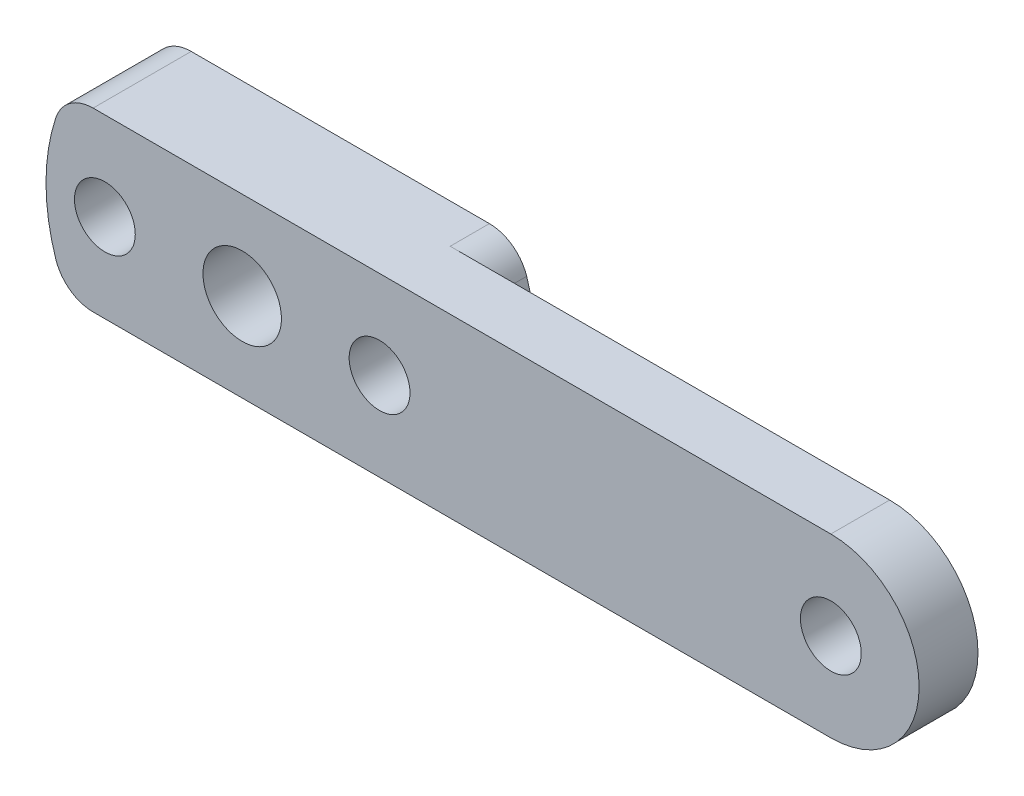
from build123d import *

# Parameters (mm, degrees)
SKETCH1_R           = 1.55
SKETCH1_R_2         = 2
BOSS_EXTRUDE1_DEPTH = 2.5
CUT_EXTRUDE1_START  = -2
CUT_EXTRUDE1_DEPTH  = 2
FILLET1_R           = 2


with BuildPart() as part:
    # Sketch1 → Boss-Extrude1 (new, symmetric)
    with BuildSketch(Plane.XY):
        with BuildLine():
            Line((-8.93028555, 4.5), (30, 4.5))
            ThreePointArc((30, 4.5), (34.5, 0), (30, -4.5))
            Line((30, -4.5), (-8.93028555, -4.5))
            ThreePointArc((-8.93028555, -4.5), (-10, 0), (-8.93028555, 4.5))
        make_face()
        with Locations((-7, 0)):
            Circle(SKETCH1_R, mode=Mode.SUBTRACT)
        with Locations((7, 0)):
            Circle(SKETCH1_R, mode=Mode.SUBTRACT)
        with Locations((30, 0)):
            Circle(SKETCH1_R, mode=Mode.SUBTRACT)
        Circle(SKETCH1_R_2, mode=Mode.SUBTRACT)
    extrude(amount=BOSS_EXTRUDE1_DEPTH, both=True)

    # Sketch2 → Cut-Extrude1 (cut)
    with BuildSketch(Plane(origin=(0, 0, -2.5), x_dir=(-1, 0, 0), z_dir=(0, 0, -1)).offset(CUT_EXTRUDE1_START)):
        with BuildLine():
            Line((-30, 4.5), (-8.93028555, 4.5))
            ThreePointArc((-8.93028555, 4.5), (-10, 0), (-8.93028555, -4.5))
            Line((-8.93028555, -4.5), (-30, -4.5))
            ThreePointArc((-30, -4.5), (-34.5, 0), (-30, 4.5))
        make_face()
    extrude(amount=CUT_EXTRUDE1_DEPTH, mode=Mode.SUBTRACT)

    # Fillet1
    fillet1_edges = [part.edges().sort_by_distance(p)[0] for p in [
        (8.93028555, 4.5, -1.5),
        (8.93028555, -4.5, -1.5),
        (-8.93028555, 4.5, 0),
        (-8.93028555, -4.5, 0),
    ]]
    fillet(fillet1_edges, radius=FILLET1_R)


solid = part.part
